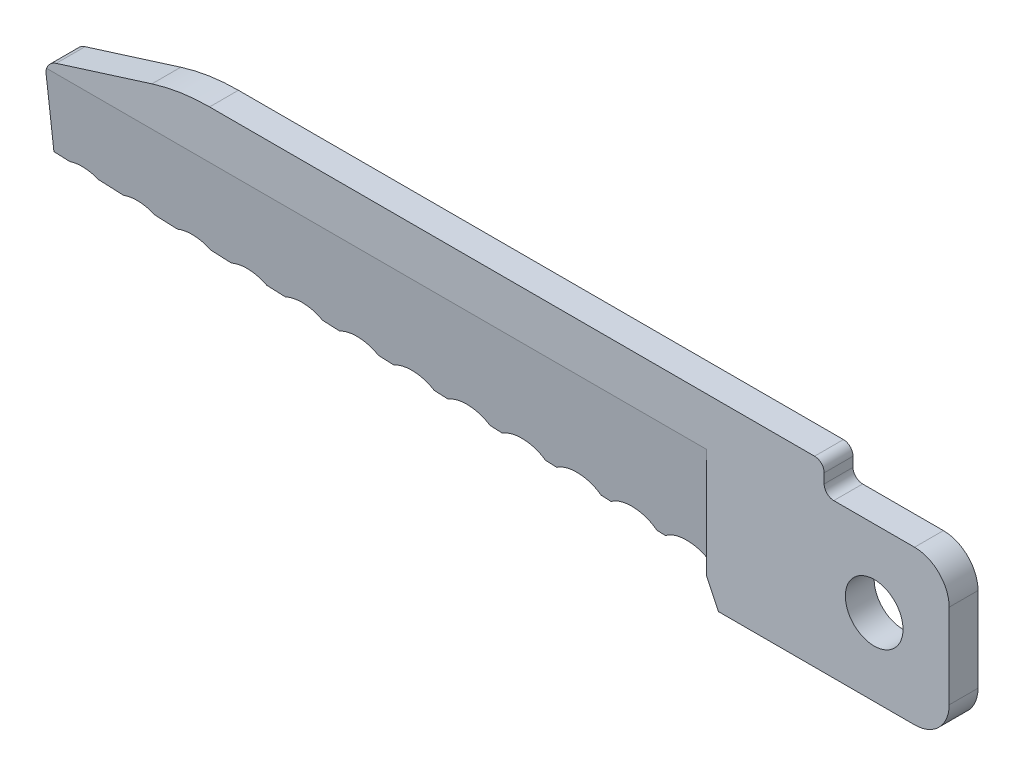
from build123d import *

# Parameters (mm, degrees)
BOSS_EXTRUDE1_DEPTH = 0.75
FILLET1_R           = 1.8
CUT_EXTRUDE3_DEPTH  = 36.680336791
SKETCH5_R           = 1.6
CUT_EXTRUDE4_DEPTH  = 20.5
LPATTERN1_COUNT     = 12
LPATTERN1_PITCH     = 2.85
SKETCH8_R           = 1.5
CUT_EXTRUDE5_DEPTH  = 20.5
CUT_REVOLVE1_ANGLE  = 90


with BuildPart() as part:
    # Sketch1 → Boss-Extrude1 (new, symmetric)
    with BuildSketch(Plane.XY):
        with BuildLine():
            Line((0, 6.712848625), (0, 3))
            Line((0, 3), (34.384210526, 1.3))
            Line((34.384210526, 1.3), (30.5, 9.5))
            Line((30.5, 9.5), (8.534429687, 9.5))
            ThreePointArc((8.534429687, 9.5), (7.017751028, 9.384315143), (5.53616372, 9.039937169))
            Line((5.53616372, 9.039937169), (0.560138723, 7.476043599))
            ThreePointArc((0.560138723, 7.476043599), (0.155062398, 7.186193625), (0, 6.712848625))
        make_face()
        with BuildLine():
            Line((30.5, 9.5), (34.384210526, 1.3))
            Line((34.384210526, 1.3), (35, 0))
            Line((35, 0), (47, 0))
            Line((47, 0), (47, 8))
            Line((47, 8), (41, 8))
            ThreePointArc((41, 8), (40.646446609, 8.146446609), (40.5, 8.5))
            Line((40.5, 8.5), (40.5, 9))
            ThreePointArc((40.5, 9), (40.353553391, 9.353553391), (40, 9.5))
            Line((40, 9.5), (30.5, 9.5))
        make_face()
    extrude(amount=BOSS_EXTRUDE1_DEPTH, both=True)

    # Fillet1
    fillet1_edges = [part.edges().sort_by_distance(p)[0] for p in [
        (47, 8, 0),
        (47, 0, 0),
    ]]
    fillet(fillet1_edges, radius=FILLET1_R)

    # Sketch4 → Cut-Extrude3 (cut, through all)
    with BuildSketch(Plane(origin=(34.384210526, 0, 0), x_dir=(0, 0, -1), z_dir=(1, 0, 0))):
        Polygon((-0.75, 1.3), (-0.125, 1.3), (-0.75, 7), align=None)
        Polygon((0.75, 1.3), (0.125, 1.3), (0.75, 7), align=None)
    extrude(amount=-CUT_EXTRUDE3_DEPTH, mode=Mode.SUBTRACT)

    # Sketch5 → Cut-Extrude4 (cut, along a direction that is not the sketch's normal)
    with BuildSketch(Plane(origin=(0, 0.001900815, 0.017335437), x_dir=(-1, 0, 0), z_dir=(0, -0.10899585570756742, -0.9940422040530147))):
        with Locations((-32.784210526, 0.634532433)):
            Circle(SKETCH5_R)
    cut_extrude4 = extrude(amount=-CUT_EXTRUDE4_DEPTH, dir=(0, 0.6987711700907747, -0.7153452675806066), mode=Mode.SUBTRACT)

    # LPattern1: Cut-Extrude4 ×12
    with Locations(*[Vector(-0.998765374567026, 0.049380256541427955, -0.005414501813753065) * (i * LPATTERN1_PITCH) for i in range(1, LPATTERN1_COUNT)]):
        add(cut_extrude4, mode=Mode.SUBTRACT)

    # Sketch8 → Cut-Extrude5 (cut)
    with BuildSketch(Plane.XY.offset(0.75)):
        with Locations((43.1, 4)):
            Circle(SKETCH8_R)
    extrude(amount=-CUT_EXTRUDE5_DEPTH, mode=Mode.SUBTRACT)

    # Sketch2 → Cut-Revolve1 (revolve, cut)
    with BuildSketch(Plane(origin=(0, 0, -0.75), x_dir=(-1, 0, 0), z_dir=(0, 0, -1))):
        with BuildLine():
            Line((-30.5, 8.5), (-16.5, 8.5))
            ThreePointArc((-16.5, 8.5), (-23.5, 7.699337741), (-30.5, 8.5))
        make_face()
    revolve(axis=Axis((30.5, 8.5, -0.75), (-1, 0, 0)), revolution_arc=CUT_REVOLVE1_ANGLE, mode=Mode.SUBTRACT)


solid = part.part
